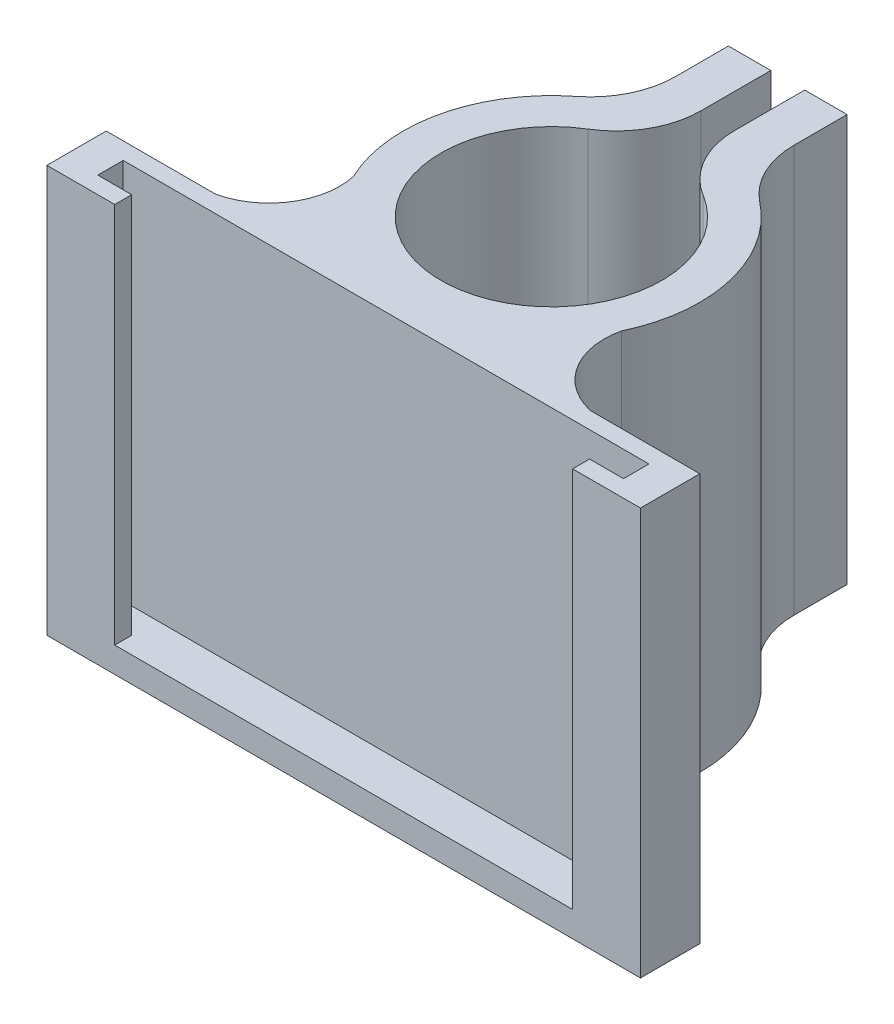
from build123d import *

# Parameters (mm, degrees)
BOSS_EXTRUDE1_DEPTH = 45
FILLET1_R           = 10
BOSS_EXTRUDE4_START = 3
BOSS_EXTRUDE4_DEPTH = 3
FILLET2_R           = 10


with BuildPart() as part:
    # Sketch1 → Boss-Extrude1 (new body)
    with BuildSketch(Plane(origin=(0, 0, 0), x_dir=(1, 0, 0), z_dir=(0, 1, 0))):
        with BuildLine():
            Line((-7, 16.039014932), (-7, 27.870533206))
            Line((-7, 27.870533206), (-2, 27.870533206))
            Line((-2, 27.870533206), (-2, 18.870533206))
            Line((-2, 18.870533206), (-2, 12.870533206))
            ThreePointArc((-2, 12.870533206), (0, -13.025), (2, 12.870533206))
            Line((2, 12.870533206), (2, 18.870533206))
            Line((2, 18.870533206), (2, 27.870533206))
            Line((2, 27.870533206), (7, 27.870533206))
            Line((7, 27.870533206), (7, 16.039014932))
            ThreePointArc((7, 16.039014932), (16.396088806, 6.117047643), (15.794877567, -7.534709195))
            ThreePointArc((15.794877567, -7.534709195), (16.882152496, -13.822605417), (22.097186029, -17.5))
            Line((22.097186029, -17.5), (35, -17.5))
            Line((35, -17.5), (35, -24.5))
            Line((35, -24.5), (27, -24.5))
            Line((27, -24.5), (27, -22.5))
            Line((27, -22.5), (31, -22.5))
            Line((31, -22.5), (31, -19.5))
            Line((31, -19.5), (-31, -19.5))
            Line((-31, -19.5), (-31, -22.5))
            Line((-31, -22.5), (-27, -22.5))
            Line((-27, -22.5), (-27, -24.5))
            Line((-27, -24.5), (-35, -24.5))
            Line((-35, -24.5), (-35, -17.5))
            Line((-35, -17.5), (-22.097186029, -17.5))
            ThreePointArc((-22.097186029, -17.5), (-16.882152496, -13.822605417), (-15.794877567, -7.534709195))
            ThreePointArc((-15.794877567, -7.534709195), (-16.396088806, 6.117047643), (-7, 16.039014932))
        make_face()
    extrude(amount=BOSS_EXTRUDE1_DEPTH)

    # Fillet1
    fillet1_edges = [part.edges().sort_by_distance(p)[0] for p in [
        (-2, 22.5, -12.870533206),
        (2, 22.5, -12.870533206),
    ]]
    fillet(fillet1_edges, radius=FILLET1_R)

    # Sketch3 → Boss-Extrude4 (add)
    with BuildSketch(Plane.XZ.offset(BOSS_EXTRUDE4_START)):
        with BuildLine():
            Line((-35, 24.5), (35, 24.5))
            Line((35, 24.5), (35, 17.5))
            Line((35, 17.5), (22.097186029, 17.5))
            ThreePointArc((22.097186029, 17.5), (16.882152496, 13.822605417), (15.794877567, 7.534709195))
            ThreePointArc((15.794877567, 7.534709195), (16.396088806, -6.117047643), (7, -16.039014932))
            Line((7, -16.039014932), (7, -27.870533206))
            Line((7, -27.870533206), (2, -27.870533206))
            Line((2, -27.870533206), (2, -19.650715636))
            ThreePointArc((2, -19.650715636), (3.27883999, -14.757723905), (6.788273616, -11.116202873))
            ThreePointArc((6.788273616, -11.116202873), (0, 13.025), (-6.788273616, -11.116202873))
            ThreePointArc((-6.788273616, -11.116202873), (-3.27883999, -14.757723905), (-2, -19.650715636))
            Line((-2, -19.650715636), (-2, -27.870533206))
            Line((-2, -27.870533206), (-7, -27.870533206))
            Line((-7, -27.870533206), (-7, -16.039014932))
            ThreePointArc((-7, -16.039014932), (-16.396088806, -6.117047643), (-15.794877567, 7.534709195))
            ThreePointArc((-15.794877567, 7.534709195), (-16.882152496, 13.822605417), (-22.097186029, 17.5))
            Line((-22.097186029, 17.5), (-35, 17.5))
            Line((-35, 17.5), (-35, 24.5))
        make_face()
    extrude(amount=-BOSS_EXTRUDE4_DEPTH)

    # Fillet2
    fillet2_edges = [part.edges().sort_by_distance(p)[0] for p in [
        (7, 22.5, -16.039014932),
        (-7, 22.5, -16.039014932),
    ]]
    fillet(fillet2_edges, radius=FILLET2_R)


solid = part.part
